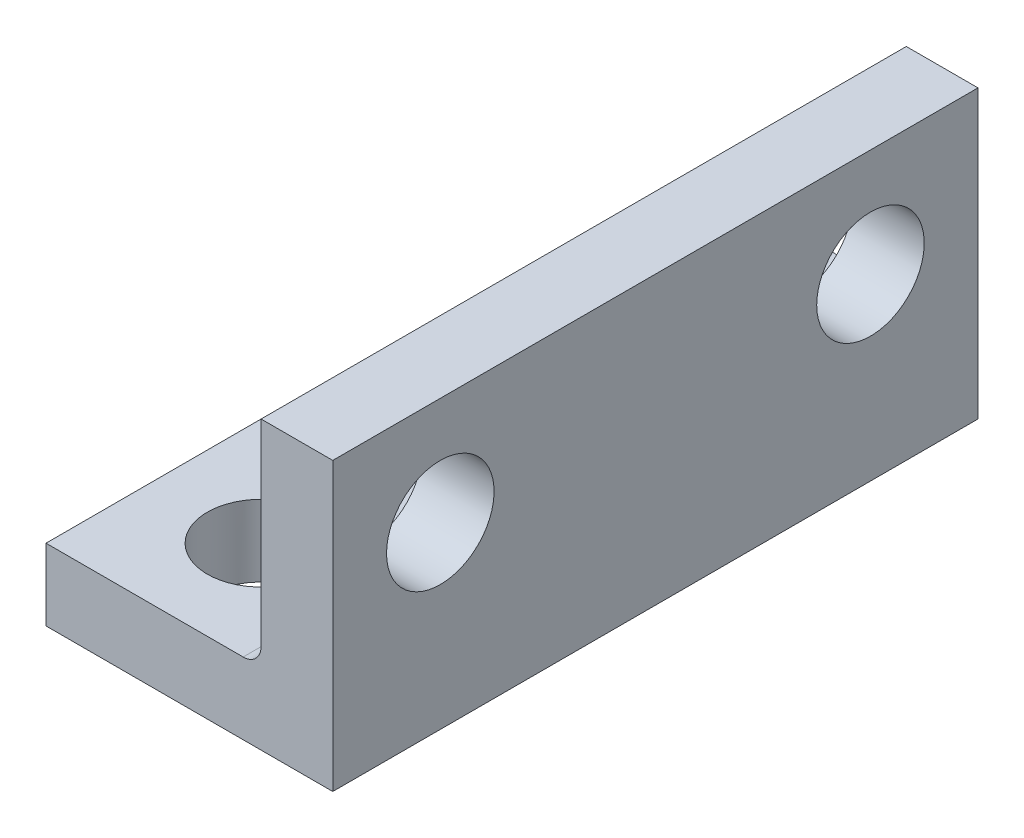
from build123d import *

# Parameters (mm, degrees)
BOSS_EXTRUDE1_DEPTH     = 18
CUT_EXTRUDE1_DEPTH      = 22.260291625
CUT_EXTRUDE1_DEPTH_BACK = 22.260291625
SKETCH2_R               = 1.5
CUT_EXTRUDE2_DEPTH      = 22.260291625
CUT_EXTRUDE2_DEPTH_BACK = 22.260291625
SKETCH3_R               = 1.5
FILLET1_R               = 0.5


with BuildPart() as part:
    # Sketch1 → Boss-Extrude1 (new body)
    with BuildSketch(Plane.XY):
        Polygon((0, 0), (-8, 0), (-8, 2), (-2, 2), (-2, 8), (0, 8), align=None)
    extrude(amount=BOSS_EXTRUDE1_DEPTH)

    # Sketch2 → Cut-Extrude1 (cut, two sides: drawn at the far end of the back side and taken through both)
    with BuildSketch(Plane(origin=(0, 0, 0), x_dir=(0, 0, -1), z_dir=(1, 0, 0)).offset(-CUT_EXTRUDE1_DEPTH_BACK)):
        with Locations(Location((-15, 5, 0), (0, 0, 90))):
            Circle(SKETCH2_R)
        with Locations(Location((-3, 5, 0), (0, 0, 90))):
            Circle(SKETCH2_R)
    extrude(amount=CUT_EXTRUDE1_DEPTH + CUT_EXTRUDE1_DEPTH_BACK, mode=Mode.SUBTRACT)

    # Sketch3 → Cut-Extrude2 (cut, two sides: drawn at the far end of the back side and taken through both)
    with BuildSketch(Plane.XZ.offset(-CUT_EXTRUDE2_DEPTH_BACK)):
        with Locations((-5, 15)):
            Circle(SKETCH3_R)
        with Locations((-5, 3)):
            Circle(SKETCH3_R)
    extrude(amount=CUT_EXTRUDE2_DEPTH + CUT_EXTRUDE2_DEPTH_BACK, mode=Mode.SUBTRACT)

    # Fillet1
    fillet1_edges = [part.edges().sort_by_distance(p)[0] for p in [
        (-2, 2, 9),
    ]]
    fillet(fillet1_edges, radius=FILLET1_R)


solid = part.part
